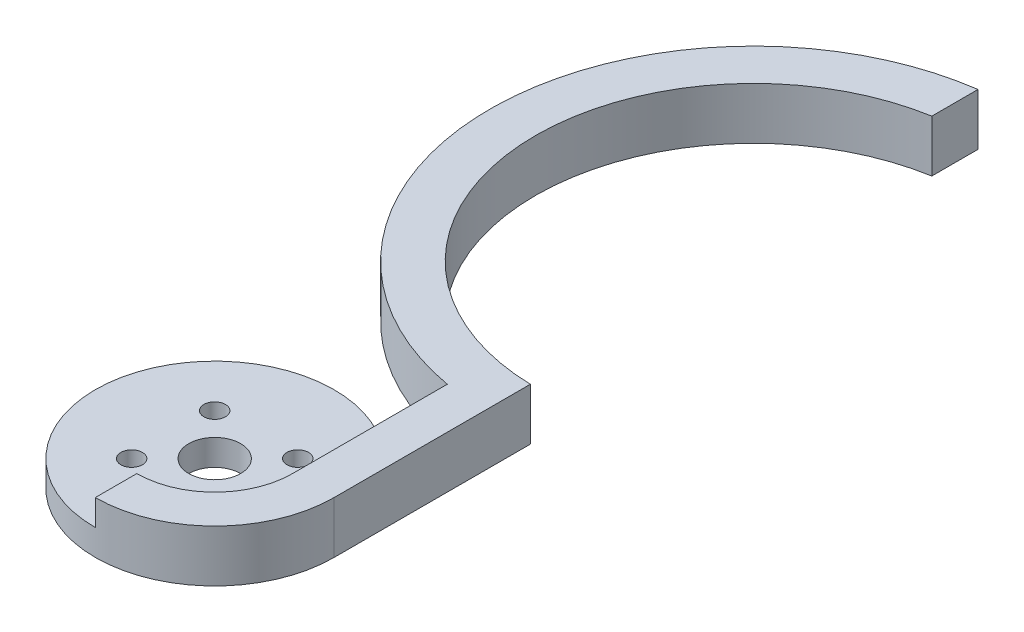
from build123d import *

# Parameters (mm, degrees)
SKETCH1_R           = 5
SKETCH1_R_2         = 2.075
BOSS_EXTRUDE1_DEPTH = 5
BOSS_EXTRUDE2_DEPTH = 10


with BuildPart() as part:
    # Sketch1 → Boss-Extrude1 (new body)
    with BuildSketch(Plane(origin=(0, 0, 0), x_dir=(1, 0, 0), z_dir=(0, 1, 0))):
        with BuildLine():
            ThreePointArc((23, 37.81190645), (-17.889435034, 76.754473357), (16.937219731, 121.201897721))
            Line((16.937219731, 121.201897721), (16.937219731, 130.106631122))
            ThreePointArc((16.937219731, 130.106631122), (-26.790527996, 80.780951543), (15, 29.80360013))
            Line((15, 29.80360013), (15, 17.435595774))
            ThreePointArc((15, 17.435595774), (-20.90454496, -9.591663047), (23, 0))
            Line((23, 0), (23, 37.81190645))
        make_face()
        Circle(SKETCH1_R, mode=Mode.SUBTRACT)
        with Locations((8, 8)):
            Circle(SKETCH1_R_2, mode=Mode.SUBTRACT)
        with Locations((-8, -8)):
            Circle(SKETCH1_R_2, mode=Mode.SUBTRACT)
        with Locations((-8, 8)):
            Circle(SKETCH1_R_2, mode=Mode.SUBTRACT)
        with Locations((8, -8)):
            Circle(SKETCH1_R_2, mode=Mode.SUBTRACT)
    extrude(amount=BOSS_EXTRUDE1_DEPTH)

    # Sketch1<3> → Boss-Extrude2 (add)
    with BuildSketch(Plane(origin=(0, 0, 0), x_dir=(1, 0, 0), z_dir=(0, 1, 0))):
        with BuildLine():
            Line((23, 23), (23, 29))
            Line((23, 29), (23, 29.009843473))
            Line((23, 29.009843473), (23, 37.81190645))
            ThreePointArc((23, 37.81190645), (19.957969223, 37.994952611), (16.937219731, 38.398102279))
            ThreePointArc((16.937219731, 38.398102279), (-18, 79.8), (16.937219731, 121.201897721))
            Line((16.937219731, 121.201897721), (16.937219731, 130.106631122))
            ThreePointArc((16.937219731, 130.106631122), (-26.790527996, 80.780951543), (15, 29.80360013))
            Line((15, 29.80360013), (15, 23))
            Line((15, 23), (15, 17.435595774))
            Line((15, 17.435595774), (15, 0))
            ThreePointArc((15, 0), (10.606601718, -10.606601718), (0, -15))
            Line((0, -15), (0, -23))
            ThreePointArc((0, -23), (16.263455967, -16.263455967), (23, 0))
            Line((23, 0), (23, 23))
        make_face()
    extrude(amount=BOSS_EXTRUDE2_DEPTH)


solid = part.part
